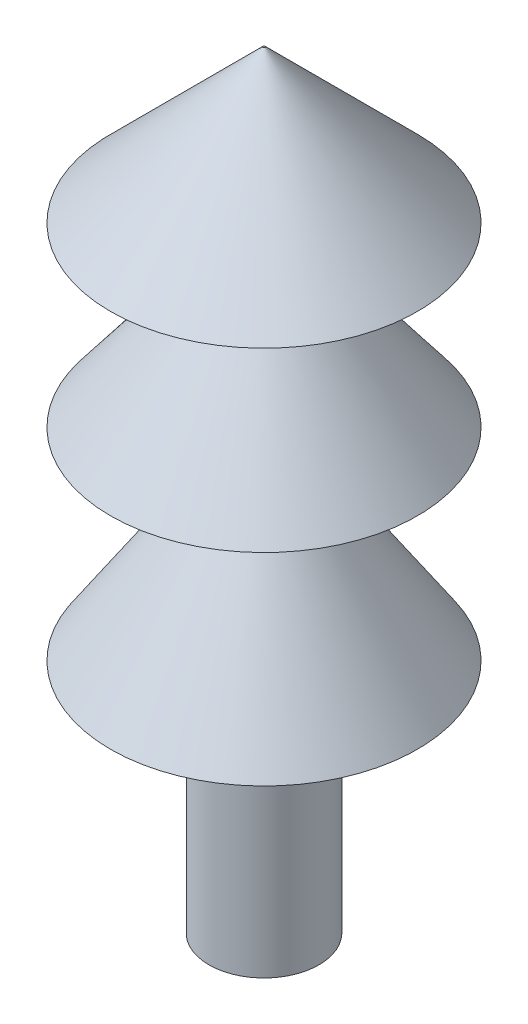
from build123d import *

# Parameters (mm, degrees)
SKETCH_1_R      = 8
EXTRUDE_1_DEPTH = 40


with BuildPart() as part:
    # 草图1 → 凸台-拉伸1 (new body)
    with BuildSketch(Plane(origin=(0, 0, 0), x_dir=(1, 0, 0), z_dir=(0, 1, 0))):
        with Locations(Location((0, 0, 0), (0, 0, 270))):
            Circle(SKETCH_1_R)
    extrude(amount=EXTRUDE_1_DEPTH)

    # 草图2 → 切除-旋转1 (revolve, cut)
    with BuildSketch(Plane(origin=(0, 0, 0), x_dir=(0, 0, -1), z_dir=(1, 0, 0)), mode=Mode.PRIVATE) as cut_revolve_1_sk:
        Polygon((-0.055370982, 40), (-8, 32.055370982), (-0.935929442, 32.055370982), (-8, 22.83286128), (-0.935929442, 22.83286128), (-8, 12.295716869), (-2.86773925, 12.295716869), (-2.86773925, -1.226951792), (-16.741646059, 0.704858016), (-12.965835978, 40), (-8.83878775, 42.326578441), align=None)
    revolve(cut_revolve_1_sk.sketch.rotate(Axis((0, 40, 0), (0, -1, 0)), 180), axis=Axis((0, 40, 0), (0, -1, 0)), mode=Mode.SUBTRACT)


solid = part.part
